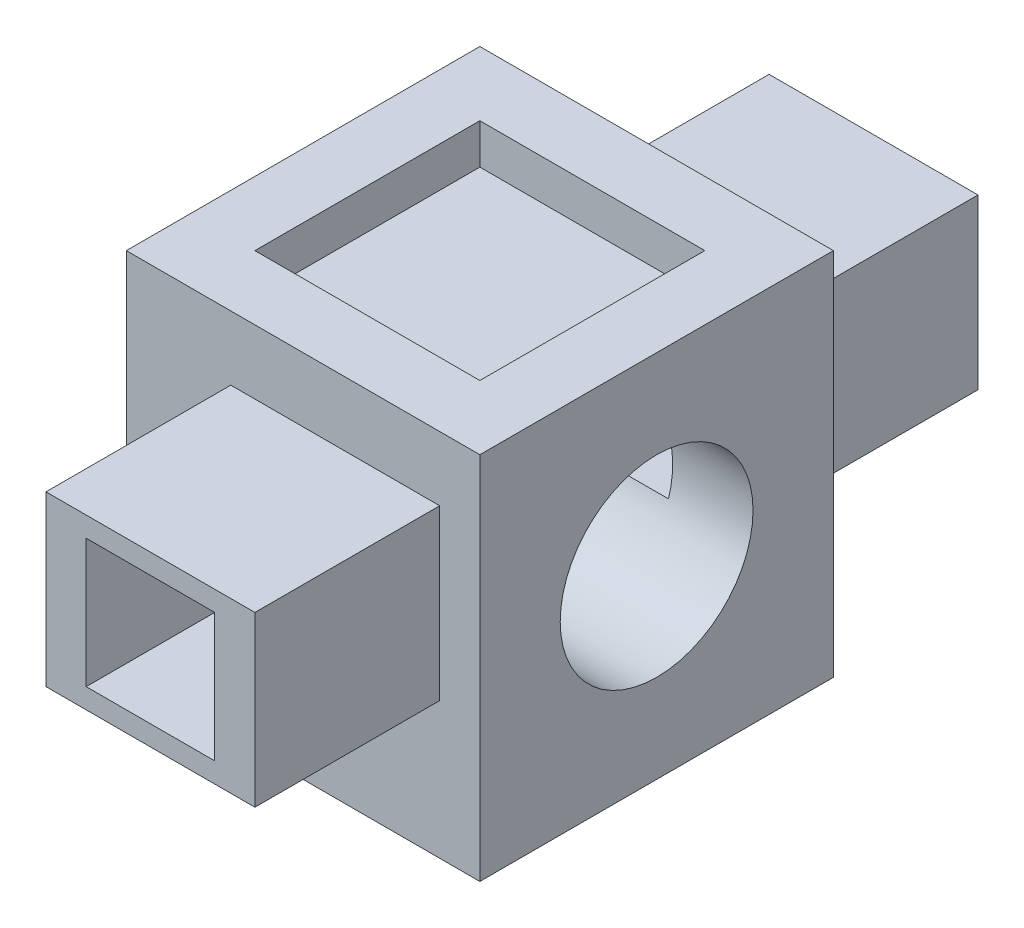
from build123d import *

# Parameters (mm, degrees)
SKETCH1_W                = 44
SKETCH1_H                = 46
BOSS_EXTRUDE1_DEPTH      = 22
BOSS_EXTRUDE3_DEPTH      = 23
BOSS_EXTRUDE3_DEPTH_BACK = 67
SKETCH4_W                = 26
SKETCH4_H                = 21
CUT_EXTRUDE1_DEPTH       = 111.236110236
CUT_EXTRUDE1_DEPTH_BACK  = 111.236110236
SKETCH5_W                = 16
SKETCH5_H                = 16
SKETCH6_R                = 12
CUT_EXTRUDE2_DEPTH       = 44
SKETCH7_W                = 28
SKETCH7_H                = 28
CUT_EXTRUDE3_DEPTH       = 5


with BuildPart() as part:
    # Sketch1 → Boss-Extrude1 (new, symmetric)
    with BuildSketch(Plane.XY):
        with Locations((22, 23)):
            Rectangle(SKETCH1_W, SKETCH1_H)
    extrude(amount=BOSS_EXTRUDE1_DEPTH, both=True)

    # Sketch4 → Boss-Extrude3 (add, two sides: drawn at the far end of the back side and taken through both)
    with BuildSketch(Plane.XY.offset(22).offset(-BOSS_EXTRUDE3_DEPTH_BACK)):
        with Locations((26, 27.5)):
            Rectangle(SKETCH4_W, SKETCH4_H)
    extrude(amount=BOSS_EXTRUDE3_DEPTH + BOSS_EXTRUDE3_DEPTH_BACK)

    # Sketch5 → Cut-Extrude1 (cut, two sides: drawn at the far end of the back side and taken through both)
    with BuildSketch(Plane.XY.offset(45).offset(-CUT_EXTRUDE1_DEPTH_BACK)):
        with Locations((26, 27.5)):
            Rectangle(SKETCH5_W, SKETCH5_H)
    extrude(amount=CUT_EXTRUDE1_DEPTH + CUT_EXTRUDE1_DEPTH_BACK, mode=Mode.SUBTRACT)

    # Sketch6 → Cut-Extrude2 (cut)
    with BuildSketch(Plane(origin=(44, 0, 0), x_dir=(0, 0, -1), z_dir=(1, 0, 0))):
        with Locations((0, 23)):
            Circle(SKETCH6_R)
    extrude(amount=-CUT_EXTRUDE2_DEPTH, mode=Mode.SUBTRACT)

    # Sketch7 → Cut-Extrude3 (cut)
    with BuildSketch(Plane(origin=(0, 46, 0), x_dir=(1, 0, 0), z_dir=(0, 1, 0))):
        with Locations((22, 0)):
            Rectangle(SKETCH7_W, SKETCH7_H)
    extrude(amount=-CUT_EXTRUDE3_DEPTH, mode=Mode.SUBTRACT)


solid = part.part
